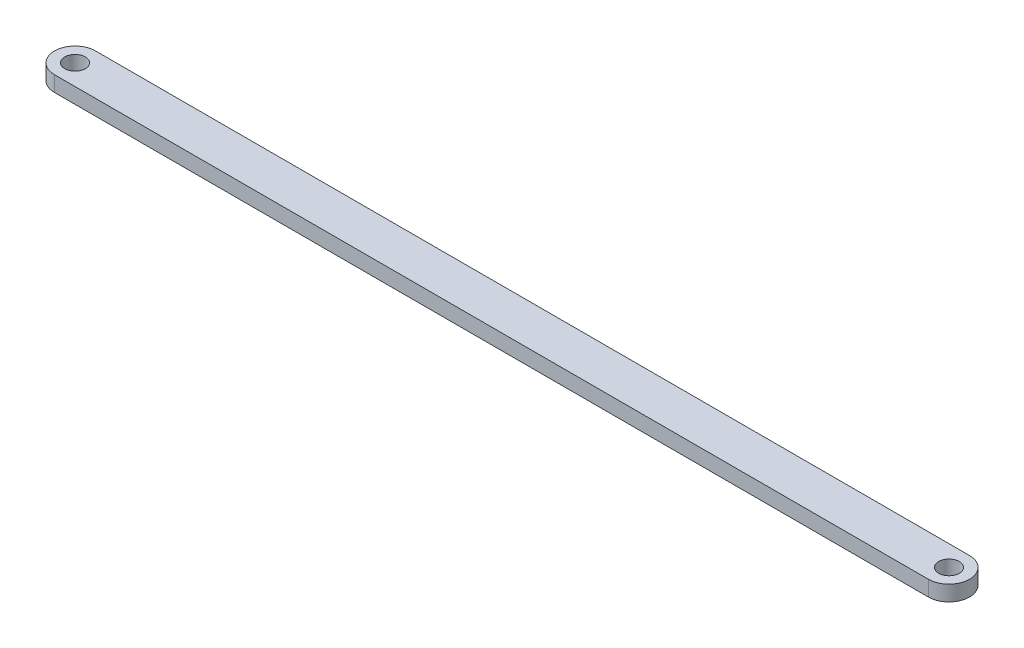
from build123d import *

# Parameters (mm, degrees)
SKETCH1_R           = 2
BOSS_EXTRUDE1_DEPTH = 3


with BuildPart() as part:
    # Sketch1 → Boss-Extrude1 (new body)
    with BuildSketch(Plane(origin=(0, 0, 0), x_dir=(1, 0, 0), z_dir=(0, 1, 0))):
        with BuildLine():
            Line((170, 4), (0, 4))
            ThreePointArc((0, 4), (-4, 0), (0, -4))
            Line((0, -4), (170, -4))
            ThreePointArc((170, -4), (174, 0), (170, 4))
        make_face()
        with Locations(Location((0, 0, 0), (0, 0, 270))):
            Circle(SKETCH1_R, mode=Mode.SUBTRACT)
        with Locations(Location((170, 0, 0), (0, 0, 270))):
            Circle(SKETCH1_R, mode=Mode.SUBTRACT)
    extrude(amount=BOSS_EXTRUDE1_DEPTH)


solid = part.part
